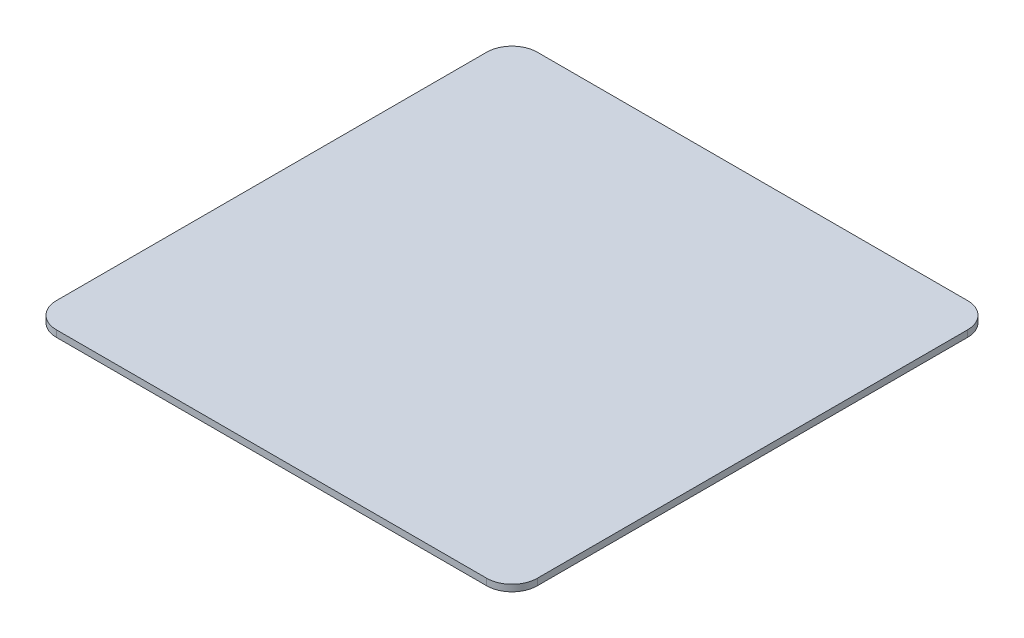
from build123d import *

# Parameters (mm, degrees)
SKETCH1_W           = 95
SKETCH1_H           = 95
BOSS_EXTRUDE1_DEPTH = 0.65
FILLET1_R           = 5


with BuildPart() as part:
    # Sketch1 → Boss-Extrude1 (new, symmetric)
    with BuildSketch(Plane(origin=(0, 0, 0), x_dir=(1, 0, 0), z_dir=(0, 1, 0))):
        Rectangle(SKETCH1_W, SKETCH1_H)
    extrude(amount=BOSS_EXTRUDE1_DEPTH, both=True)

    # Fillet1
    fillet1_edges = [part.edges().sort_by_distance(p)[0] for p in [
        (47.5, 0, 47.5),
        (-47.5, 0, 47.5),
        (-47.5, 0, -47.5),
        (47.5, 0, -47.5),
    ]]
    fillet(fillet1_edges, radius=FILLET1_R)


solid = part.part
